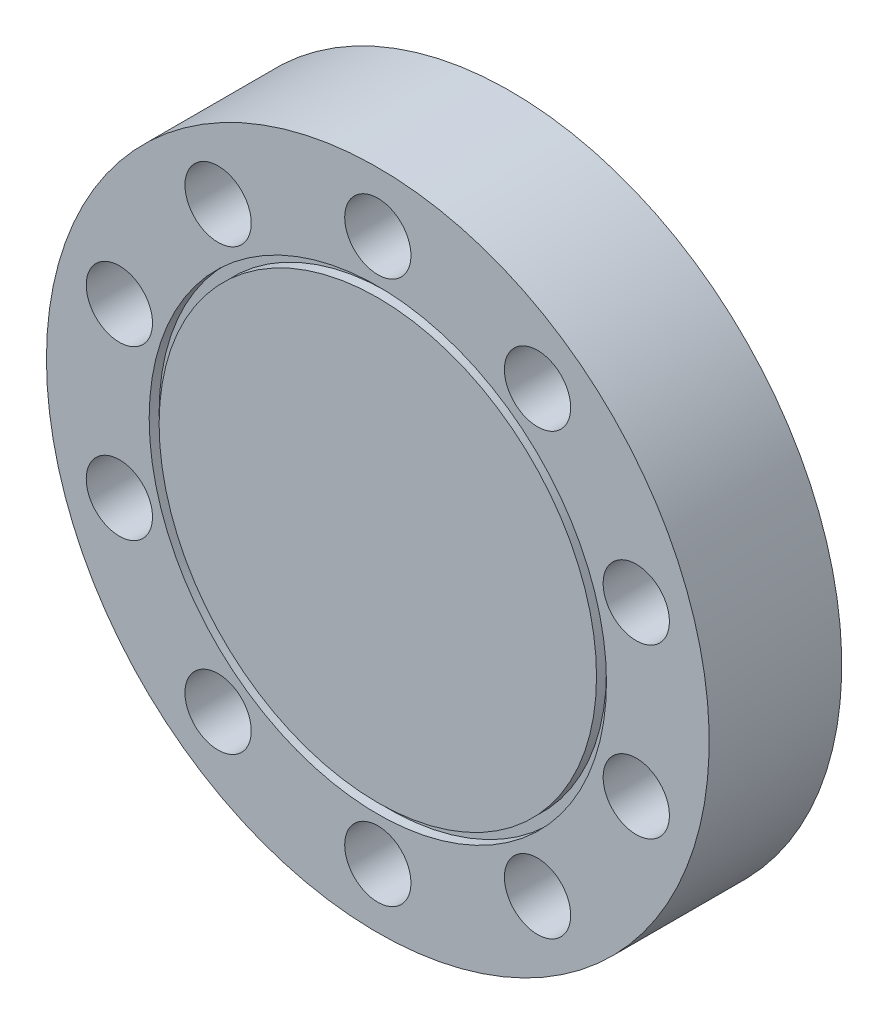
from build123d import *

# Parameters (mm, degrees)
SKETCH1_R           = 50
SKETCH1_R_2         = 5
BOSS_EXTRUDE1_DEPTH = 20
SKETCH2_R           = 34.5
SKETCH2_R_2         = 33
CUT_EXTRUDE1_DEPTH  = 1.5


with BuildPart() as part:
    # Sketch1 → Boss-Extrude1 (new body)
    with BuildSketch(Plane.XY):
        Circle(SKETCH1_R)
        with Locations((0, -41)):
            Circle(SKETCH1_R_2, mode=Mode.SUBTRACT)
        with Locations((-24.099195344, -33.169696769)):
            Circle(SKETCH1_R_2, mode=Mode.SUBTRACT)
        with Locations((-38.993317168, -12.669696769)):
            Circle(SKETCH1_R_2, mode=Mode.SUBTRACT)
        with Locations((-38.993317168, 12.669696769)):
            Circle(SKETCH1_R_2, mode=Mode.SUBTRACT)
        with Locations((-24.099195344, 33.169696769)):
            Circle(SKETCH1_R_2, mode=Mode.SUBTRACT)
        with Locations((0, 41)):
            Circle(SKETCH1_R_2, mode=Mode.SUBTRACT)
        with Locations((24.099195344, 33.169696769)):
            Circle(SKETCH1_R_2, mode=Mode.SUBTRACT)
        with Locations((38.993317168, 12.669696769)):
            Circle(SKETCH1_R_2, mode=Mode.SUBTRACT)
        with Locations((38.993317168, -12.669696769)):
            Circle(SKETCH1_R_2, mode=Mode.SUBTRACT)
        with Locations((24.099195344, -33.169696769)):
            Circle(SKETCH1_R_2, mode=Mode.SUBTRACT)
    extrude(amount=BOSS_EXTRUDE1_DEPTH)

    # Sketch2 → Cut-Extrude1 (cut)
    with BuildSketch(Plane.XY.offset(20)):
        Circle(SKETCH2_R)
        Circle(SKETCH2_R_2, mode=Mode.SUBTRACT)
    extrude(amount=-CUT_EXTRUDE1_DEPTH, mode=Mode.SUBTRACT)


solid = part.part
